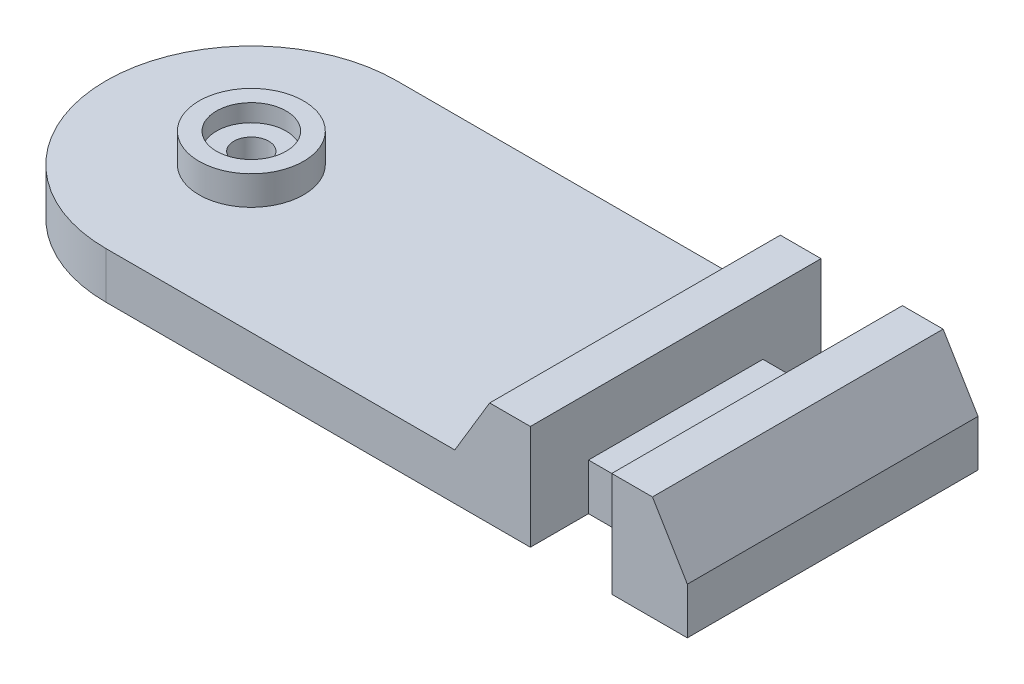
from build123d import *

# Parameters (mm, degrees)
EXTRUDE_1_DEPTH     = 4
SKETCH_2_R          = 4.5
SKETCH_2_R_2        = 3
EXTRUDE_2_DEPTH     = 2.5
EXTRUDE_3_DEPTH     = 25
SKETCH_4_W          = 7
SKETCH_4_H          = 5
CUT_EXTRUDE_1_DEPTH = 57.621550668
SKETCH_5_W          = 7
SKETCH_5_H          = 5
CUT_EXTRUDE_2_DEPTH = 52.780787943
SKETCH_6_R          = 3
SKETCH_6_R_2        = 1.5
EXTRUDE_4_DEPTH     = 1


with BuildPart() as part:
    # 草图1 → 凸台-拉伸1 (new body)
    with BuildSketch(Plane(origin=(0, 0, 0), x_dir=(1, 0, 0), z_dir=(0, 1, 0))):
        with BuildLine():
            ThreePointArc((12.5, 0), (8.838834765, 8.838834765), (0, 12.5))
            ThreePointArc((0, 12.5), (-8.838834765, 8.838834765), (-12.5, 0))
            Line((-12.5, 0), (-1.5, 0))
            ThreePointArc((-1.5, 0), (0, 1.5), (1.5, 0))
            Line((1.5, 0), (12.5, 0))
        make_face()
        with BuildLine():
            ThreePointArc((0, -12.5), (8.838834765, -8.838834765), (12.5, 0))
            Line((12.5, 0), (1.5, 0))
            ThreePointArc((1.5, 0), (0, -1.5), (-1.5, 0))
            Line((-1.5, 0), (-12.5, 0))
            ThreePointArc((-12.5, 0), (-8.838834765, -8.838834765), (0, -12.5))
        make_face()
        with BuildLine():
            Line((50, 12.5), (0, 12.5))
            ThreePointArc((0, 12.5), (8.838834765, 8.838834765), (12.5, 0))
            Line((12.5, 0), (38.5, 0))
            ThreePointArc((38.5, 0), (40, 1.5), (41.5, 0))
            Line((41.5, 0), (50, 0))
            Line((50, 0), (50, 12.5))
        make_face()
        with BuildLine():
            Line((38.5, 0), (12.5, 0))
            ThreePointArc((12.5, 0), (8.838834765, -8.838834765), (0, -12.5))
            Line((0, -12.5), (50, -12.5))
            Line((50, -12.5), (50, 0))
            Line((50, 0), (41.5, 0))
            ThreePointArc((41.5, 0), (40, -1.5), (38.5, 0))
        make_face()
    extrude(amount=EXTRUDE_1_DEPTH)

    # 草图2 → 凸台-拉伸2 (add)
    with BuildSketch(Plane(origin=(0, 4, 0), x_dir=(1, 0, 0), z_dir=(0, 1, 0))):
        with Locations(Location((0, 0, 0), (0, 0, 270))):
            Circle(SKETCH_2_R)
        with Locations(Location((0, 0, 0), (0, 0, 270))):
            Circle(SKETCH_2_R_2, mode=Mode.SUBTRACT)
    extrude(amount=EXTRUDE_2_DEPTH)

    # 草图3 → 凸台-拉伸3 (add)
    with BuildSketch(Plane.XY.offset(12.5)):
        Polygon((33, 9), (47, 9), (50, 4), (30, 4), align=None)
    extrude(amount=-EXTRUDE_3_DEPTH)

    # 草图4 → 切除-拉伸1 (cut, through all)
    with BuildSketch(Plane.XY.offset(12.5)):
        with Locations((40, 6.5)):
            Rectangle(SKETCH_4_W, SKETCH_4_H)
    extrude(amount=-CUT_EXTRUDE_1_DEPTH, mode=Mode.SUBTRACT)

    # 草图5 → 切除-拉伸2 (cut, through all)
    with BuildSketch(Plane(origin=(0, 4, 0), x_dir=(1, 0, 0), z_dir=(0, 1, 0))):
        with Locations((40, -10)):
            Rectangle(SKETCH_5_W, SKETCH_5_H)
        with Locations((40, 10)):
            Rectangle(SKETCH_5_W, SKETCH_5_H)
    extrude(amount=-CUT_EXTRUDE_2_DEPTH, mode=Mode.SUBTRACT)

    # 草图6 → 凸台-拉伸4 (add)
    with BuildSketch(Plane(origin=(0, 4, 0), x_dir=(1, 0, 0), z_dir=(0, 1, 0))):
        with Locations(Location((0, 0, 0), (0, 0, 270))):
            Circle(SKETCH_6_R)
        with Locations(Location((0, 0, 0), (0, 0, 270))):
            Circle(SKETCH_6_R_2, mode=Mode.SUBTRACT)
    extrude(amount=EXTRUDE_4_DEPTH)


solid = part.part
